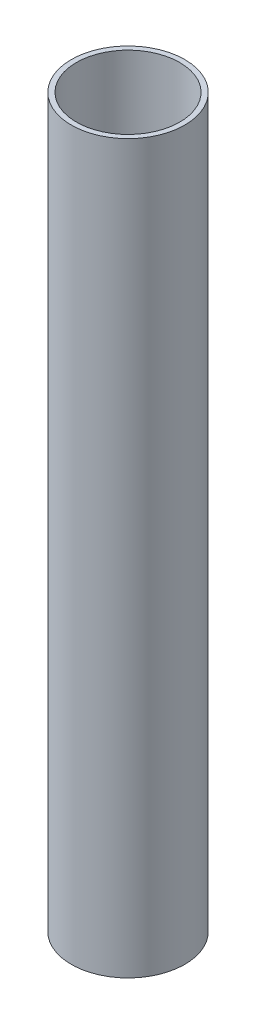
from build123d import *

# Parameters (mm, degrees)
SKETCH1_W = 0.7112
SKETCH1_H = 101.6


with BuildPart() as part:
    # Sketch1 → Revolve1 (revolve)
    with BuildSketch(Plane.XY, mode=Mode.PRIVATE) as revolve1_sk:
        with Locations((7.57809, 50.8)):
            Rectangle(SKETCH1_W, SKETCH1_H)
    revolve(revolve1_sk.sketch.rotate(Axis((0, 101.6, 0), (0, -1, 0)), 270), axis=Axis((0, 101.6, 0), (0, -1, 0)))


solid = part.part
